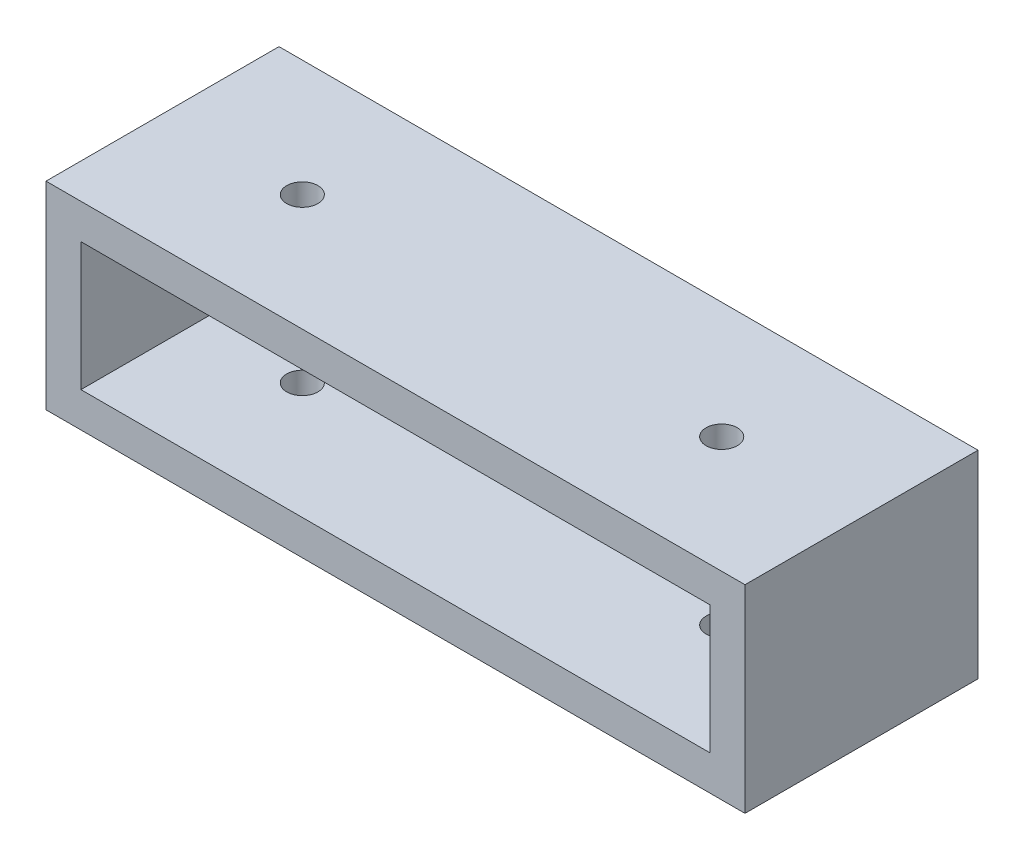
from build123d import *

# Parameters (mm, degrees)
SKETCH1_W           = 150
SKETCH1_H           = 50
BOSS_EXTRUDE1_DEPTH = 7.5
SKETCH2_R           = 3.35
CUT_EXTRUDE1_DEPTH  = 7.5
SKETCH3_W           = 15
SKETCH3_H           = 50
BOSS_EXTRUDE2_DEPTH = 35
SKETCH6_W           = 50
SKETCH6_H           = 7.5
BOSS_EXTRUDE5_DEPTH = 120
SKETCH10_R          = 3.35
CUT_EXTRUDE4_DEPTH  = 7.5
SKETCH11_W          = 50
SKETCH11_H          = 27.5
CUT_EXTRUDE5_DEPTH  = 7.5
SKETCH12_W          = 50
SKETCH12_H          = 27.5
CUT_EXTRUDE6_DEPTH  = 7.5


with BuildPart() as part:
    # Sketch1 → Boss-Extrude1 (new body)
    with BuildSketch(Plane(origin=(0, 0, 0), x_dir=(1, 0, 0), z_dir=(0, 1, 0))):
        Rectangle(SKETCH1_W, SKETCH1_H)
    extrude(amount=BOSS_EXTRUDE1_DEPTH)

    # Sketch2 → Cut-Extrude1 (cut)
    with BuildSketch(Plane(origin=(0, 7.5, 0), x_dir=(1, 0, 0), z_dir=(0, 1, 0))):
        with Locations(Location((-45, 0, 0), (0, 0, 270))):
            Circle(SKETCH2_R)
        with Locations(Location((45, 0, 0), (0, 0, 270))):
            Circle(SKETCH2_R)
    extrude(amount=-CUT_EXTRUDE1_DEPTH, mode=Mode.SUBTRACT)

    # Sketch3 → Boss-Extrude2 (add)
    with BuildSketch(Plane.XZ):
        with Locations((-67.5, 0)):
            Rectangle(SKETCH3_W, SKETCH3_H)
        with Locations((67.5, 0)):
            Rectangle(SKETCH3_W, SKETCH3_H)
    extrude(amount=BOSS_EXTRUDE2_DEPTH)

    # Sketch6 → Boss-Extrude5 (add)
    with BuildSketch(Plane(origin=(-60, 0, 0), x_dir=(0, 0, -1), z_dir=(1, 0, 0))):
        with Locations((0, -31.25)):
            Rectangle(SKETCH6_W, SKETCH6_H)
    extrude(amount=BOSS_EXTRUDE5_DEPTH)

    # Sketch10 → Cut-Extrude4 (cut)
    with BuildSketch(Plane(origin=(0, -27.5, 0), x_dir=(1, 0, 0), z_dir=(0, 1, 0))):
        with Locations(Location((-45, 0, 0), (0, 0, 270))):
            Circle(SKETCH10_R)
        with Locations(Location((45, 0, 0), (0, 0, 270))):
            Circle(SKETCH10_R)
    extrude(amount=-CUT_EXTRUDE4_DEPTH, mode=Mode.SUBTRACT)

    # Sketch11 → Cut-Extrude5 (cut)
    with BuildSketch(Plane(origin=(-60, 0, 0), x_dir=(0, 0, -1), z_dir=(1, 0, 0))):
        with Locations((0, -13.75)):
            Rectangle(SKETCH11_W, SKETCH11_H)
    extrude(amount=-CUT_EXTRUDE5_DEPTH, mode=Mode.SUBTRACT)

    # Sketch12 → Cut-Extrude6 (cut)
    with BuildSketch(Plane.ZY.offset(-60)):
        with Locations((0, -13.75)):
            Rectangle(SKETCH12_W, SKETCH12_H)
    extrude(amount=-CUT_EXTRUDE6_DEPTH, mode=Mode.SUBTRACT)


solid = part.part
